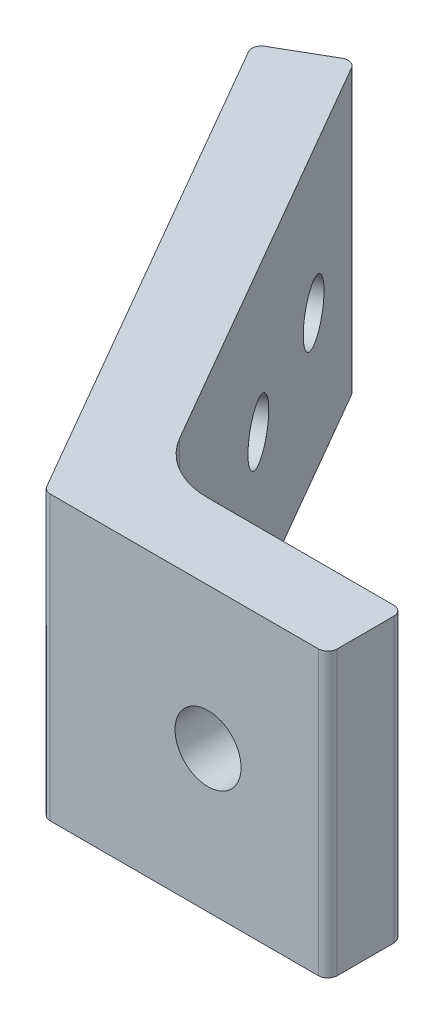
from build123d import *

# Parameters (mm, degrees)
EXTRUDE_1_DEPTH        = 15
SKETCH_2_R             = 1.5
CUT_EXTRUDE_1_DEPTH    = 15
PATTERN_LINEAR_1_COUNT = 3
PATTERN_LINEAR_1_PITCH = 8
SKETCH_3_R             = 1.75
CUT_EXTRUDE_2_DEPTH    = 15
FILLET_1_R             = 4
FILLET_2_R             = 0.5


with BuildPart() as part:
    # Эскиз1 → Бобышка-Вытянуть1 (new body)
    with BuildSketch(Plane(origin=(0, 0, 0), x_dir=(1, 0, 0), z_dir=(0, 1, 0))):
        Polygon((-15, 25.980762114), (0, 0), (15, 0), (15, 4), (2.309401077, 4), (-11.535898385, 27.980762114), align=None)
    extrude(amount=EXTRUDE_1_DEPTH)

    # Эскиз2 → Вырез-Вытянуть1 (cut)
    with BuildSketch(Plane(origin=(3.464101615, 0, -2), x_dir=(-0.49999999999999806, 0, -0.8660254037844397), z_dir=(0.8660254037844397, 0, -0.49999999999999806))):
        with Locations((24, 7.5)):
            Circle(SKETCH_2_R)
    cut_extrude_1 = extrude(amount=-CUT_EXTRUDE_1_DEPTH, mode=Mode.SUBTRACT)

    # Линейный массив1: Вырез-Вытянуть1 ×3
    with Locations(*[Vector(0.49999999999999806, 0, 0.8660254037844397) * (i * PATTERN_LINEAR_1_PITCH) for i in range(1, PATTERN_LINEAR_1_COUNT)]):
        add(cut_extrude_1, mode=Mode.SUBTRACT)

    # Эскиз3 → Вырез-Вытянуть2 (cut)
    with BuildSketch(Plane(origin=(0, 0, -4), x_dir=(-1, 0, 0), z_dir=(0, 0, -1))):
        with Locations((-8.654700538, 7.5)):
            Circle(SKETCH_3_R)
    extrude(amount=-CUT_EXTRUDE_2_DEPTH, mode=Mode.SUBTRACT)

    # Скругление1
    fillet_1_edges = [part.edges().sort_by_distance(p)[0] for p in [
        (2.309401077, 7.5, -4),
    ]]
    fillet(fillet_1_edges, radius=FILLET_1_R)

    # Скругление2
    fillet_2_edges = [part.edges().sort_by_distance(p)[0] for p in [
        (0, 7.5, 0),
        (-15, 7.5, -25.980762114),
        (-11.535898385, 7.5, -27.980762114),
        (15, 7.5, -4),
        (15, 7.5, 0),
    ]]
    fillet(fillet_2_edges, radius=FILLET_2_R)


solid = part.part
